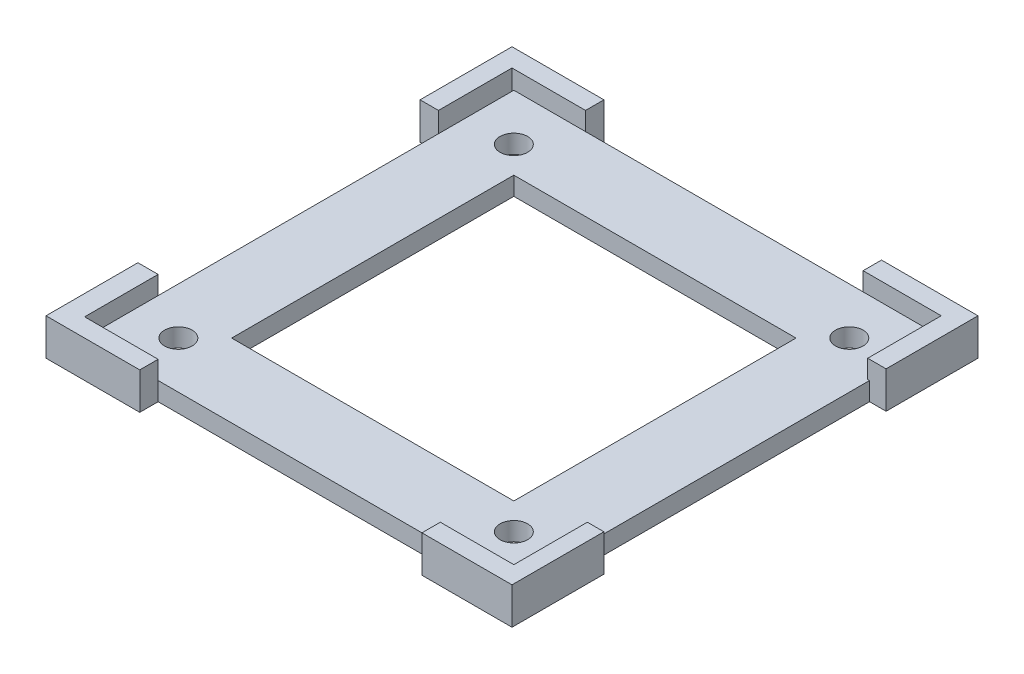
from build123d import *

# Parameters (mm, degrees)
SKETCH1_R           = 1.5
SKETCH1_W           = 30.7
SKETCH1_H           = 30.7
BOSS_EXTRUDE1_DEPTH = 2
BOSS_EXTRUDE2_DEPTH = 4


with BuildPart() as part:
    # Sketch1 → Boss-Extrude1 (new body)
    with BuildSketch(Plane(origin=(0, 0, 0), x_dir=(1, 0, 0), z_dir=(0, 1, 0))):
        Polygon((-22.005550203, -21.814567772), (-14.005550203, -21.814567772), (16.694449797, -21.814567772), (24.694449797, -21.814567772), (24.694449797, -13.814567772), (24.694449797, 16.669052986), (24.694449797, 24.885432228), (-22.005550203, 24.885432228), (-22.005550203, 15.385432228), (-22.005550203, -15.314567772), align=None)
        with Locations(Location((-16.905550203, 19.785432228, 0), (0, 0, 270))):
            Circle(SKETCH1_R, mode=Mode.SUBTRACT)
        with Locations(Location((-16.905550203, -16.714567772, 0), (0, 0, 270))):
            Circle(SKETCH1_R, mode=Mode.SUBTRACT)
        with Locations(Location((19.594449797, 19.785432228, 0), (0, 0, 270))):
            Circle(SKETCH1_R, mode=Mode.SUBTRACT)
        with Locations(Location((19.594449797, -16.714567772, 0), (0, 0, 270))):
            Circle(SKETCH1_R, mode=Mode.SUBTRACT)
        with Locations((1.344449797, 1.535432228)):
            Rectangle(SKETCH1_W, SKETCH1_H, mode=Mode.SUBTRACT)
    extrude(amount=BOSS_EXTRUDE1_DEPTH)

    # Sketch3 → Boss-Extrude2 (add)
    with BuildSketch(Plane(origin=(0, 0, 0), x_dir=(1, 0, 0), z_dir=(0, 1, 0))):
        Polygon((-14.205550203, 24.885432228), (-14.205550203, 26.885432228), (-24.205550203, 26.885432228), (-24.205550203, 16.885432228), (-22.205550203, 16.885432228), (-22.205550203, 24.885432228), align=None)
        Polygon((-22.005550203, -13.814567772), (-24.205550203, -13.814567772), (-24.205550203, -23.814567772), (-14.005550203, -23.814567772), (-14.005550203, -21.814567772), (-22.005550203, -21.814567772), align=None)
        Polygon((15.994449797, 26.885432228), (26.494449797, 26.885432228), (26.494449797, 16.885432228), (24.494449797, 16.885432228), (24.494449797, 24.885432228), (15.994449797, 24.885432228), align=None)
        Polygon((16.694449797, -21.814567772), (16.694449797, -23.814567772), (26.494449797, -23.814567772), (26.494449797, -13.814567772), (24.694449797, -13.814567772), (24.694449797, -21.814567772), align=None)
    extrude(amount=BOSS_EXTRUDE2_DEPTH)


solid = part.part
